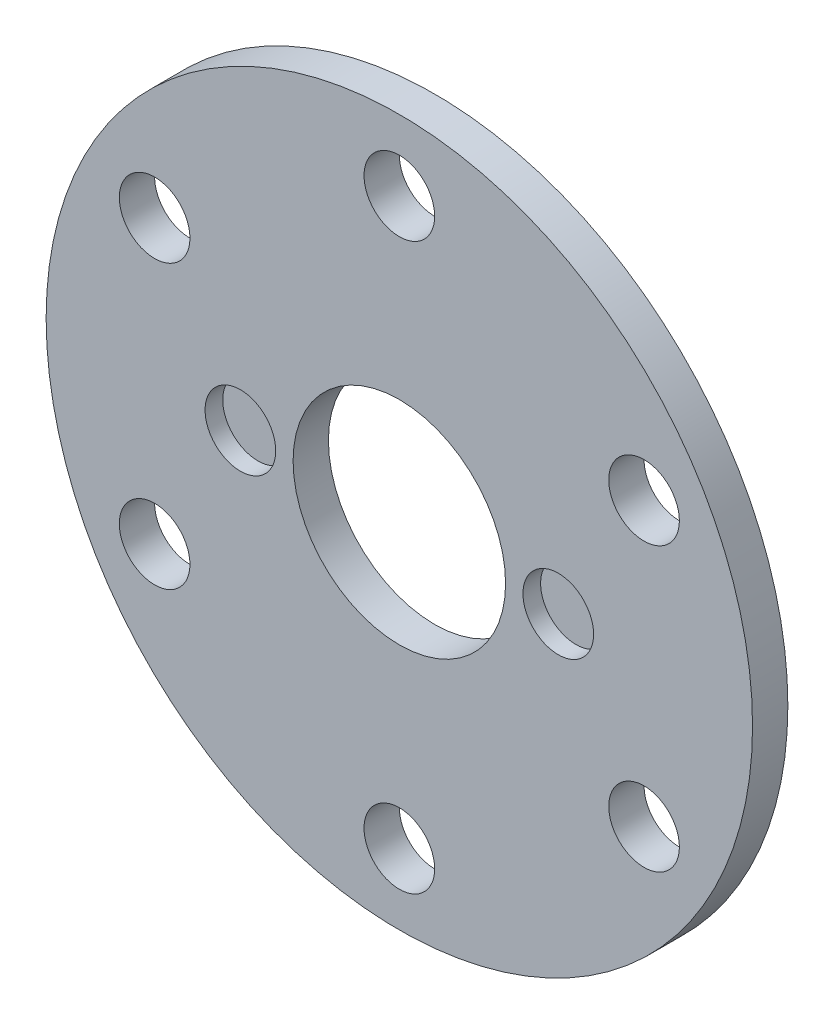
from build123d import *

# Parameters (mm, degrees)
SKETCH1_R           = 31.75
SKETCH1_R_2         = 3.175
SKETCH1_R_3         = 15.875
SKETCH1_R_4         = 9.5504
BOSS_EXTRUDE1_DEPTH = 3.175
SKETCH2_R           = 3.175
CUT_EXTRUDE1_DEPTH  = 1.5875


with BuildPart() as part:
    # Sketch1 → Boss-Extrude1 (new body)
    # profile 1 of 2: a face of its own
    with BuildSketch(Plane.XY.offset(191.201675)):
        with Locations((0, 762.756140976)):
            Circle(SKETCH1_R)
        with Locations((-21.997045256, 775.456140976)):
            Circle(SKETCH1_R_2, mode=Mode.SUBTRACT)
        with Locations((-21.997045256, 750.056140976)):
            Circle(SKETCH1_R_2, mode=Mode.SUBTRACT)
        with Locations((0, 737.356140976)):
            Circle(SKETCH1_R_2, mode=Mode.SUBTRACT)
        with Locations((21.997045256, 750.056140976)):
            Circle(SKETCH1_R_2, mode=Mode.SUBTRACT)
        with Locations((21.997045256, 775.456140976)):
            Circle(SKETCH1_R_2, mode=Mode.SUBTRACT)
        with Locations((0, 788.156140976)):
            Circle(SKETCH1_R_2, mode=Mode.SUBTRACT)
        with Locations((0, 762.756140976)):
            Circle(SKETCH1_R_3, mode=Mode.SUBTRACT)
    # profile 2 of 2: a face of its own
    with BuildSketch(Plane.XY.offset(191.201675)):
        with Locations((0, 762.756140976)):
            Circle(SKETCH1_R_3)
        with Locations((0, 762.756140976)):
            Circle(SKETCH1_R_4, mode=Mode.SUBTRACT)
    extrude(amount=BOSS_EXTRUDE1_DEPTH)

    # Sketch2 → Cut-Extrude1 (cut)
    with BuildSketch(Plane.XY.offset(194.376675)):
        with Locations((-14.2875, 762.756140976)):
            Circle(SKETCH2_R)
        with Locations((14.2875, 762.756140976)):
            Circle(SKETCH2_R)
    extrude(amount=-CUT_EXTRUDE1_DEPTH, mode=Mode.SUBTRACT)


solid = part.part
